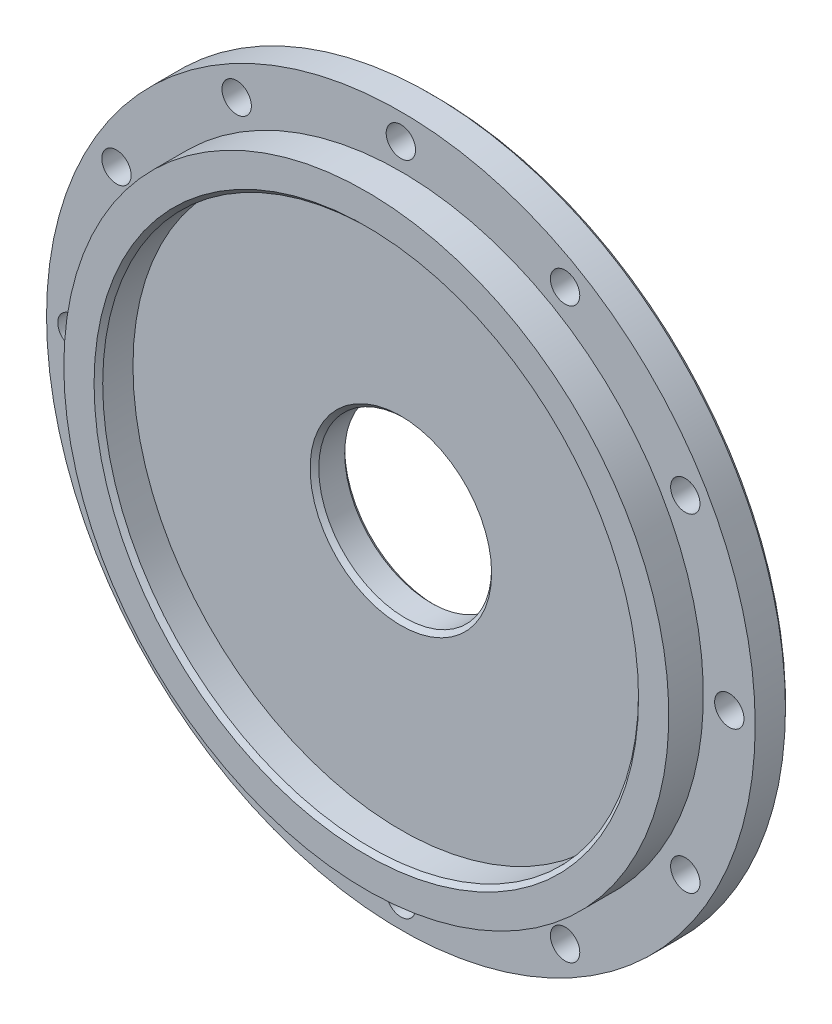
from build123d import *

# Parameters (mm, degrees)
CUT_EXTRUDE_1_REACH = 60.121
SKETCH_2_R          = 1.7
CUT_EXTRUDE_2_REACH = 60.532
SKETCH_3_R          = 10
CHAMFER_1_SIZE      = 0.5


with BuildPart() as part:
    # 草图1 → 旋转1 (revolve)
    with BuildSketch(Plane(origin=(0, 0, 0), x_dir=(0, 0, -1), z_dir=(1, 0, 0)), mode=Mode.PRIVATE) as revolve_1_sk:
        Polygon((0, 0), (0, 41), (-4, 41), (-4, 35), (-8, 35), (-8, 31), (-4, 31), (-4, 0), align=None)
    revolve(revolve_1_sk.sketch.rotate(Axis((0, 0, 0), (0, 0, 1)), 90), axis=Axis((0, 0, 0), (0, 0, 1)))

    # 草图2 → 切除-拉伸1 (cut, up to next)
    with BuildSketch(Plane.XY.offset(4), mode=Mode.PRIVATE) as cut_extrude_1_sk1:
        with Locations((0, 38)):
            Circle(SKETCH_2_R)
    cut_extrude_1_tool1 = extrude(cut_extrude_1_sk1.sketch, amount=-CUT_EXTRUDE_1_REACH, mode=Mode.PRIVATE) & part.part
    # 草图2 → 切除-拉伸1 (cut, up to next)
    with BuildSketch(Plane.XY.offset(4), mode=Mode.PRIVATE) as cut_extrude_1_sk2:
        with Locations((19, 32.908965344)):
            Circle(SKETCH_2_R)
    cut_extrude_1_tool2 = extrude(cut_extrude_1_sk2.sketch, amount=-CUT_EXTRUDE_1_REACH, mode=Mode.PRIVATE) & part.part
    # 草图2 → 切除-拉伸1 (cut, up to next)
    with BuildSketch(Plane.XY.offset(4), mode=Mode.PRIVATE) as cut_extrude_1_sk3:
        with Locations((32.908965344, 19)):
            Circle(SKETCH_2_R)
    cut_extrude_1_tool3 = extrude(cut_extrude_1_sk3.sketch, amount=-CUT_EXTRUDE_1_REACH, mode=Mode.PRIVATE) & part.part
    # 草图2 → 切除-拉伸1 (cut, up to next)
    with BuildSketch(Plane.XY.offset(4), mode=Mode.PRIVATE) as cut_extrude_1_sk4:
        with Locations((38, 0)):
            Circle(SKETCH_2_R)
    cut_extrude_1_tool4 = extrude(cut_extrude_1_sk4.sketch, amount=-CUT_EXTRUDE_1_REACH, mode=Mode.PRIVATE) & part.part
    # 草图2 → 切除-拉伸1 (cut, up to next)
    with BuildSketch(Plane.XY.offset(4), mode=Mode.PRIVATE) as cut_extrude_1_sk5:
        with Locations((32.908965344, -19)):
            Circle(SKETCH_2_R)
    cut_extrude_1_tool5 = extrude(cut_extrude_1_sk5.sketch, amount=-CUT_EXTRUDE_1_REACH, mode=Mode.PRIVATE) & part.part
    # 草图2 → 切除-拉伸1 (cut, up to next)
    with BuildSketch(Plane.XY.offset(4), mode=Mode.PRIVATE) as cut_extrude_1_sk6:
        with Locations((19, -32.908965344)):
            Circle(SKETCH_2_R)
    cut_extrude_1_tool6 = extrude(cut_extrude_1_sk6.sketch, amount=-CUT_EXTRUDE_1_REACH, mode=Mode.PRIVATE) & part.part
    # 草图2 → 切除-拉伸1 (cut, up to next)
    with BuildSketch(Plane.XY.offset(4), mode=Mode.PRIVATE) as cut_extrude_1_sk7:
        with Locations((0, -38)):
            Circle(SKETCH_2_R)
    cut_extrude_1_tool7 = extrude(cut_extrude_1_sk7.sketch, amount=-CUT_EXTRUDE_1_REACH, mode=Mode.PRIVATE) & part.part
    # 草图2 → 切除-拉伸1 (cut, up to next)
    with BuildSketch(Plane.XY.offset(4), mode=Mode.PRIVATE) as cut_extrude_1_sk8:
        with Locations((-19, -32.908965344)):
            Circle(SKETCH_2_R)
    cut_extrude_1_tool8 = extrude(cut_extrude_1_sk8.sketch, amount=-CUT_EXTRUDE_1_REACH, mode=Mode.PRIVATE) & part.part
    # 草图2 → 切除-拉伸1 (cut, up to next)
    with BuildSketch(Plane.XY.offset(4), mode=Mode.PRIVATE) as cut_extrude_1_sk9:
        with Locations((-32.908965344, -19)):
            Circle(SKETCH_2_R)
    cut_extrude_1_tool9 = extrude(cut_extrude_1_sk9.sketch, amount=-CUT_EXTRUDE_1_REACH, mode=Mode.PRIVATE) & part.part
    # 草图2 → 切除-拉伸1 (cut, up to next)
    with BuildSketch(Plane.XY.offset(4), mode=Mode.PRIVATE) as cut_extrude_1_sk10:
        with Locations((-38, 0)):
            Circle(SKETCH_2_R)
    cut_extrude_1_tool10 = extrude(cut_extrude_1_sk10.sketch, amount=-CUT_EXTRUDE_1_REACH, mode=Mode.PRIVATE) & part.part
    # 草图2 → 切除-拉伸1 (cut, up to next)
    with BuildSketch(Plane.XY.offset(4), mode=Mode.PRIVATE) as cut_extrude_1_sk11:
        with Locations((-32.908965344, 19)):
            Circle(SKETCH_2_R)
    cut_extrude_1_tool11 = extrude(cut_extrude_1_sk11.sketch, amount=-CUT_EXTRUDE_1_REACH, mode=Mode.PRIVATE) & part.part
    # 草图2 → 切除-拉伸1 (cut, up to next)
    with BuildSketch(Plane.XY.offset(4), mode=Mode.PRIVATE) as cut_extrude_1_sk12:
        with Locations((-19, 32.908965344)):
            Circle(SKETCH_2_R)
    cut_extrude_1_tool12 = extrude(cut_extrude_1_sk12.sketch, amount=-CUT_EXTRUDE_1_REACH, mode=Mode.PRIVATE) & part.part
    add(cut_extrude_1_tool1.solids().sort_by_distance((0, 38, 4))[0], mode=Mode.SUBTRACT)
    add(cut_extrude_1_tool2.solids().sort_by_distance((19, 32.908965, 4))[0], mode=Mode.SUBTRACT)
    add(cut_extrude_1_tool3.solids().sort_by_distance((32.908965, 19, 4))[0], mode=Mode.SUBTRACT)
    add(cut_extrude_1_tool4.solids().sort_by_distance((38, 0, 4))[0], mode=Mode.SUBTRACT)
    add(cut_extrude_1_tool5.solids().sort_by_distance((32.908965, -19, 4))[0], mode=Mode.SUBTRACT)
    add(cut_extrude_1_tool6.solids().sort_by_distance((19, -32.908965, 4))[0], mode=Mode.SUBTRACT)
    add(cut_extrude_1_tool7.solids().sort_by_distance((0, -38, 4))[0], mode=Mode.SUBTRACT)
    add(cut_extrude_1_tool8.solids().sort_by_distance((-19, -32.908965, 4))[0], mode=Mode.SUBTRACT)
    add(cut_extrude_1_tool9.solids().sort_by_distance((-32.908965, -19, 4))[0], mode=Mode.SUBTRACT)
    add(cut_extrude_1_tool10.solids().sort_by_distance((-38, 0, 4))[0], mode=Mode.SUBTRACT)
    add(cut_extrude_1_tool11.solids().sort_by_distance((-32.908965, 19, 4))[0], mode=Mode.SUBTRACT)
    add(cut_extrude_1_tool12.solids().sort_by_distance((-19, 32.908965, 4))[0], mode=Mode.SUBTRACT)

    # 草图3 → 切除-拉伸2 (cut, up to next)
    with BuildSketch(Plane(origin=(0, 0, 0), x_dir=(-1, 0, 0), z_dir=(0, 0, -1)), mode=Mode.PRIVATE) as cut_extrude_2_sk1:
        Circle(SKETCH_3_R)
    cut_extrude_2_tool1 = extrude(cut_extrude_2_sk1.sketch, amount=-CUT_EXTRUDE_2_REACH, mode=Mode.PRIVATE) & part.part
    add(cut_extrude_2_tool1.solids().sort_by_distance((0, 0, 0))[0], mode=Mode.SUBTRACT)

    # 倒角1
    chamfer_1_edges = [part.edges().sort_by_distance(p)[0] for p in [
        (10, 0, 4),
        (10, 0, 0),
        (31, 0, 8),
        (41, 0, 0),
    ]]
    chamfer(chamfer_1_edges, length=CHAMFER_1_SIZE)


solid = part.part
